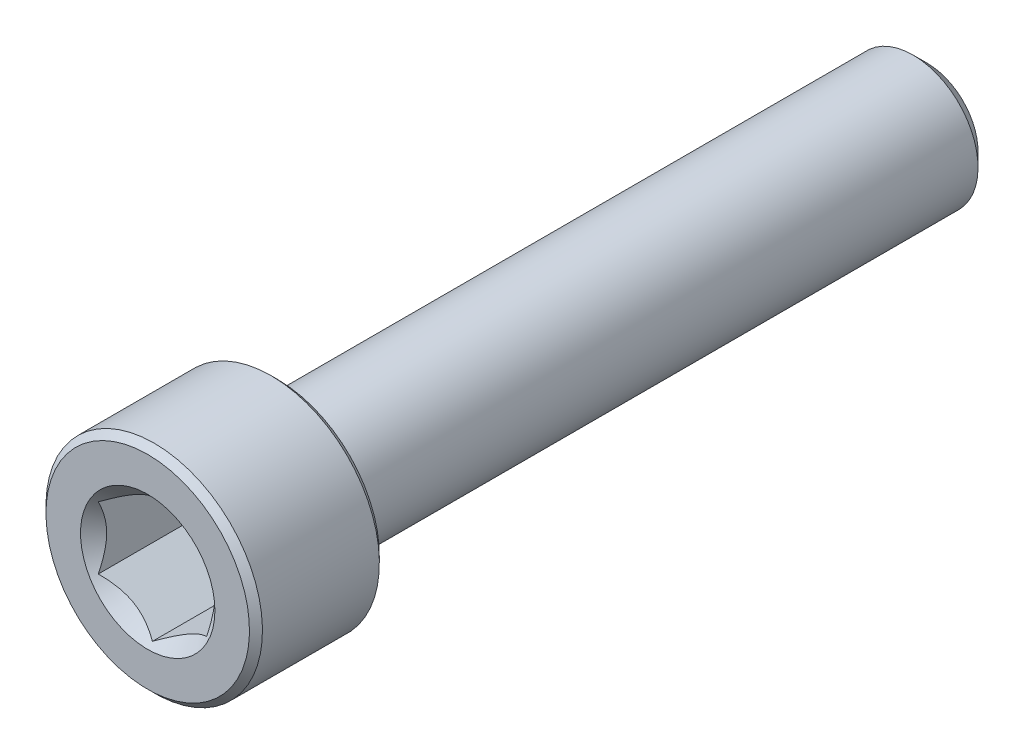
from build123d import *

# Parameters (mm, degrees)
CUT_EXTRUDE1_DEPTH = 5
SKETCH4_R          = 3.103257697
CUT_EXTRUDE2_DEPTH = 3
CUT_EXTRUDE2_DRAFT = -45


with BuildPart() as part:
    # Sketch2 → Revolve1 (revolve)
    with BuildSketch(Plane(origin=(0, 0, 0), x_dir=(0, 0, -1), z_dir=(1, 0, 0))):
        with BuildLine():
            Line((-18, 0), (-18, 4.7))
            Line((-18, 4.7), (-17.7, 5))
            Line((-17.7, 5), (-12.3, 5))
            Line((-12.3, 5), (-12, 4.7))
            Line((-12, 4.7), (-12, 3.3))
            ThreePointArc((-12, 3.3), (-11.912132034, 3.087867966), (-11.7, 3))
            Line((-11.7, 3), (17.350480947, 3))
            Line((17.350480947, 3), (18, 2.350480947))
            Line((18, 2.350480947), (18, 0))
            Line((18, 0), (-18, 0))
        make_face()
    revolve(axis=Axis((0, 0, -18), (0, 0, 1)))

    # Sketch3 → Cut-Extrude1 (cut)
    with BuildSketch(Plane.XY.offset(18)):
        Polygon((2.5, -1.443375673), (2.5, 1.443375673), (0, 2.886751346), (-2.5, 1.443375673), (-2.5, -1.443375673), (0, -2.886751346), align=None)
    extrude(amount=-CUT_EXTRUDE1_DEPTH, mode=Mode.SUBTRACT)


with BuildPart() as cut_extrude2_tool:
    # Sketch4 → Cut-Extrude2 (with draft: the straight prism first)
    with BuildSketch(Plane.XY.offset(18)):
        Circle(SKETCH4_R)
    extrude(amount=-CUT_EXTRUDE2_DEPTH)
    # Cut-Extrude2: the draft: its side faces are tilted about the plane it starts from
    cut_extrude2_sides = [cut_extrude2_tool.faces().sort_by_distance(p)[0] for p in [
        (-3.103257697, 0, 16.5),
    ]]
    draft(cut_extrude2_sides, Plane.XY.offset(18), CUT_EXTRUDE2_DRAFT)


with BuildPart() as part_1:
    add(part.part)

    # Cut-Extrude2: cut by cut_extrude2_tool
    add(cut_extrude2_tool.part, mode=Mode.SUBTRACT)


solid = part_1.part
